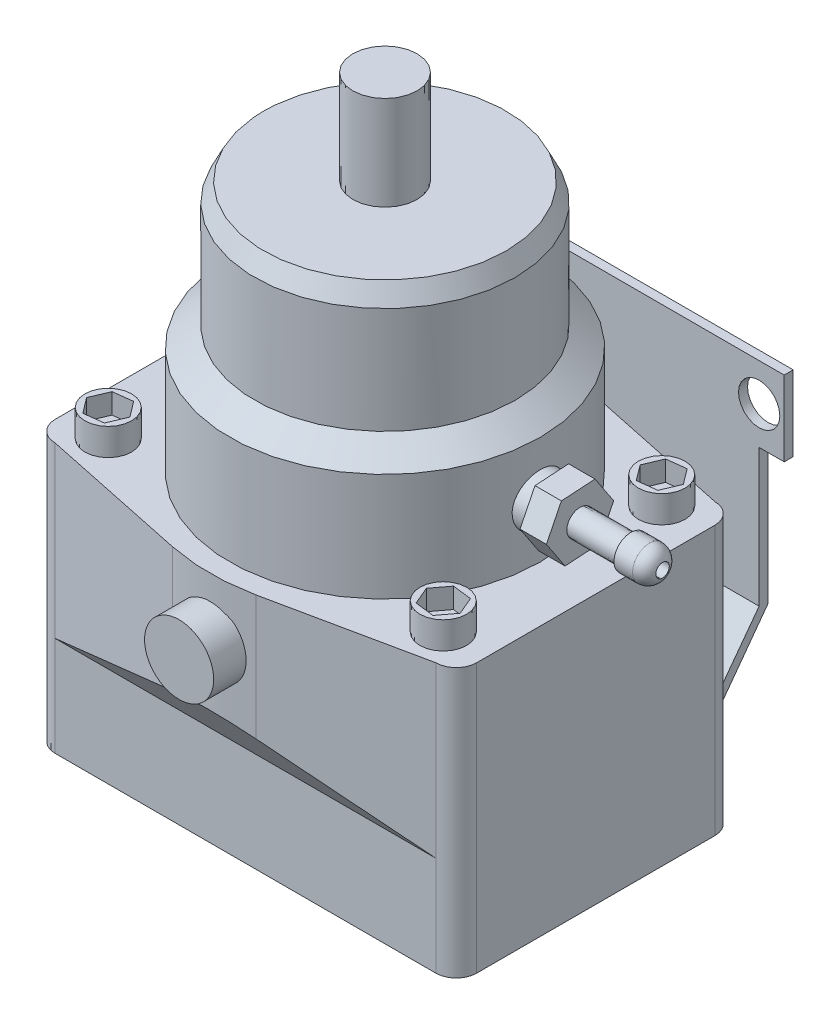
from build123d import *

# Parameters (mm, degrees)
BOSS_EXTRUDE1_DEPTH     = 39.7
BOSS_EXTRUDE2_DEPTH     = 25
CUT_EXTRUDE1_DEPTH      = 100
SKETCH5_R               = 9.905
CUT_EXTRUDE3_DEPTH      = 21.5
SKETCH6_R               = 6.25
CUT_EXTRUDE4_DEPTH      = 37
BOSS_EXTRUDE4_REACH     = 104.296
CUT_EXTRUDE5_DEPTH      = 6
SKETCH12_W              = 10.134962234
SKETCH12_H              = 11.9
CUT_EXTRUDE7_DEPTH      = 1.5
SKETCH13_W              = 5.35926975
SKETCH13_H              = 13.277386283
CUT_EXTRUDE8_DEPTH      = 1.5
SKETCH15_R              = 3.05
CUT_EXTRUDE9_DEPTH      = 5.9
SKETCH16_R              = 4.75
BOSS_EXTRUDE6_DEPTH     = 13.9
SKETCH19_R              = 5.1
BOSS_EXTRUDE7_DEPTH     = 4.8
SKETCH20_R              = 3.45
BOSS_EXTRUDE8_DEPTH     = 4
CUT_EXTRUDE10_DEPTH     = 103
MIRROR3_COPY_1_SKETCH_R = 3.45
MIRROR3_COPY_1_DEPTH    = 4
MIRROR3_COPY_2_DEPTH    = 103
SKETCH22_R              = 3.9
BOSS_EXTRUDE9_DEPTH     = 5.6
CUT_EXTRUDE11_DEPTH     = 3.6
SKETCH24_R              = 3.85
BOSS_EXTRUDE10_DEPTH    = 2.9
BOSS_EXTRUDE11_DEPTH    = 3.9
SKETCH27_R              = 1.95
BOSS_EXTRUDE12_DEPTH    = 7.5
SKETCH28_R              = 2.5
BOSS_EXTRUDE13_DEPTH    = 4.75
FILLET3_R               = 2
SKETCH29_R              = 1
CUT_EXTRUDE12_DEPTH     = 23.75
CUT_SWEEP3_PITCH        = 1
CUT_SWEEP3_HEIGHT       = 13
CUT_SWEEP3_RADIUS       = 4.75
CUT_SWEEP3_START_ANGLE  = -135
SKETCH31_R              = 0.015992225


with BuildPart() as part:
    # Sketch1 → Boss-Extrude1 (new body)
    with BuildSketch(Plane(origin=(0, 0, 0), x_dir=(1, 0, 0), z_dir=(0, 1, 0))):
        with BuildLine():
            Line((28.125, -20.6), (-28.125, -20.6))
            ThreePointArc((-28.125, -20.6), (-30.246320344, -19.721320344), (-31.125, -17.6))
            Line((-31.125, -17.6), (-31.125, 17.6))
            ThreePointArc((-31.125, 17.6), (-30.246320344, 19.721320344), (-28.125, 20.6))
            Line((-28.125, 20.6), (28.125, 20.6))
            ThreePointArc((28.125, 20.6), (30.246320344, 19.721320344), (31.125, 17.6))
            Line((31.125, 17.6), (31.125, -17.6))
            ThreePointArc((31.125, -17.6), (30.246320344, -19.721320344), (28.125, -20.6))
        make_face()
    extrude(amount=BOSS_EXTRUDE1_DEPTH)

    # Sketch2 → Boss-Extrude2 (add)
    with BuildSketch(Plane(origin=(0, 39.7, 0), x_dir=(1, 0, 0), z_dir=(0, 1, 0))):
        with BuildLine():
            Line((-28.125, -20.6), (-6.159267825, -25.207922483))
            ThreePointArc((-6.159267825, -25.207922483), (0, -25.847005946), (6.159267825, -25.207922483))
            Line((6.159267825, -25.207922483), (28.125, -20.6))
            Line((28.125, -20.6), (-28.125, -20.6))
        make_face()
    boss_extrude2 = extrude(amount=-BOSS_EXTRUDE2_DEPTH)

    # Sketch3 → Cut-Extrude1 (cut)
    with BuildSketch(Plane(origin=(31.125, 0, 0), x_dir=(0, 0, -1), z_dir=(1, 0, 0))):
        Polygon((-32.744605148, 11.464392257), (-24.817313872, 11.464392257), (-20.6, 14.7), (-25.847005946, 22.2), (-31.552633413, 18.2083385), align=None)
    cut_extrude1 = extrude(amount=-CUT_EXTRUDE1_DEPTH, mode=Mode.SUBTRACT)

    # Sketch5 → Cut-Extrude3 (cut)
    with BuildSketch(Plane.ZY.offset(31.125)):
        with Locations((0, 17.1)):
            Circle(SKETCH5_R)
    extrude(amount=-CUT_EXTRUDE3_DEPTH, mode=Mode.SUBTRACT)

    # Sketch6 → Cut-Extrude4 (cut)
    with BuildSketch(Plane(origin=(0, 0, 0), x_dir=(-1, 0, 0), z_dir=(0, -1, 0))):
        with Locations(Location((0, 0, 0), (0, 0, 90))):
            Circle(SKETCH6_R)
    extrude(amount=-CUT_EXTRUDE4_DEPTH, mode=Mode.SUBTRACT)

    # Mirror1: Boss-Extrude2, Cut-Extrude1 across plane
    add(boss_extrude2.mirror(Plane.XY))
    add(cut_extrude1.mirror(Plane.XY), mode=Mode.SUBTRACT)

    # Sketch8 → Revolve1 (revolve)
    with BuildSketch(Plane.XY, mode=Mode.PRIVATE) as revolve1_sk:
        Polygon((0, 76.95), (0, 39.7), (22.95, 39.7), (22.95, 55.643444458), (19.24291256, 58.521395188), (19.24291256, 74.221395188), (17.9046595, 76.95), align=None)
    revolve(revolve1_sk.sketch.rotate(Axis((0, 76.95, 0), (0, -1, 0)), 180), axis=Axis((0, 76.95, 0), (0, -1, 0)))

    # Boss-Extrude4: up to this face of the body (flat: up to its plane)
    boss_extrude4_end = Plane(part.part.faces().sort_by_distance((-31.125, 19.85, 17.069422013))[0])
    # Sketch10 → Boss-Extrude4 (add, up to the picked face)
    with BuildSketch(Plane(origin=(31.125, 0, 0), x_dir=(0, 0, -1), z_dir=(1, 0, 0)), mode=Mode.PRIVATE) as boss_extrude4_sk1:
        Polygon((20.6, 0), (22.1, 0), (22.1, 12.5), (29.156948175, 22.081726486), (29.156948175, 53.781726486), (27.821308706, 53.781726486), (27.821308706, 22.374306059), (20.6, 12.680726118), align=None)
    boss_extrude4_tool1 = split(extrude(boss_extrude4_sk1.sketch, amount=-BOSS_EXTRUDE4_REACH, mode=Mode.PRIVATE), bisect_by=boss_extrude4_end, keep=Keep.BOTH, mode=Mode.PRIVATE)
    add(boss_extrude4_tool1.solids().sort_by(Axis((31.125, 0.544582, -21.35), (-1, 0, 0)))[0])

    # Sketch11 → Cut-Extrude5 (cut)
    with BuildSketch(Plane(origin=(0, 0, -32.156948175), x_dir=(-1, 0, 0), z_dir=(0, 0, -1))):
        Polygon((-35.70828559, 51.946762291), (-31.125, 53.781726486), (-31.125, 42.681726486), (-27.425, 42.681726486), (-27.425, 22.081726486), (-35.70828559, 22.081726486), align=None)
        Polygon((31.125, 22.081726486), (27.425, 22.081726486), (27.425, 42.681726486), (31.125, 42.681726486), (31.125, 53.781726486), (39.820148779, 56.491453184), (37.87242411, 26.842755452), align=None)
    extrude(amount=-CUT_EXTRUDE5_DEPTH, mode=Mode.SUBTRACT)

    # Sketch12 → Cut-Extrude7 (cut)
    with BuildSketch(Plane(origin=(0, -6.156667924, -8.359351188), x_dir=(-1, 0, 0), z_dir=(0, -0.5930208550475103, -0.8051870996723182))):
        with Locations((32.492481117, 29.120599642)):
            Rectangle(SKETCH12_W, SKETCH12_H)
        Polygon((-27.425, 35.070599642), (-27.425, 23.170599642), (-42.264689881, 23.170599642), (-41.407824832, 35.070599642), align=None)
    extrude(amount=-CUT_EXTRUDE7_DEPTH, mode=Mode.SUBTRACT)

    # Sketch13 → Cut-Extrude8 (cut)
    with BuildSketch(Plane(origin=(0, 0, -22.1), x_dir=(-1, 0, 0), z_dir=(0, 0, -1))):
        with Locations((-30.104634875, 6.638693142)):
            Rectangle(SKETCH13_W, SKETCH13_H)
        with Locations((30.104634875, 6.638693142)):
            Rectangle(SKETCH13_W, SKETCH13_H)
    extrude(amount=-CUT_EXTRUDE8_DEPTH, mode=Mode.SUBTRACT)

    # Sketch15 → Cut-Extrude9 (cut)
    with BuildSketch(Plane(origin=(0, 0, -32.156948175), x_dir=(-1, 0, 0), z_dir=(0, 0, -1))):
        with Locations((27.425, 48.231726486)):
            Circle(SKETCH15_R)
        with Locations((-27.425, 48.231726486)):
            Circle(SKETCH15_R)
    extrude(amount=-CUT_EXTRUDE9_DEPTH, mode=Mode.SUBTRACT)

    # Sketch16 → Boss-Extrude6 (add)
    with BuildSketch(Plane(origin=(0, 76.95, 0), x_dir=(1, 0, 0), z_dir=(0, 1, 0))):
        Circle(SKETCH16_R)
    extrude(amount=BOSS_EXTRUDE6_DEPTH)

    # Sketch20 → Boss-Extrude8 (add)
    with BuildSketch(Plane(origin=(0, 39.7, 0), x_dir=(1, 0, 0), z_dir=(0, 1, 0))):
        with Locations(Location((-24.735401996, 16.128070491, 0), (0, 0, 90))):
            Circle(SKETCH20_R)
    boss_extrude8 = extrude(amount=BOSS_EXTRUDE8_DEPTH)

    # Sketch21 → Cut-Extrude10 (cut)
    with BuildSketch(Plane(origin=(0, 143.7, 0), x_dir=(1, 0, 0), z_dir=(0, 1, 0))):
        Polygon((-23.61717672, 13.490155922), (-21.891788328, 15.777524703), (-23.010013605, 18.415439272), (-25.853627273, 18.76598506), (-27.579015664, 16.478616279), (-26.460790388, 13.84070171), align=None)
    cut_extrude10 = extrude(amount=-CUT_EXTRUDE10_DEPTH, mode=Mode.SUBTRACT)

    # Mirror2: Boss-Extrude8, Cut-Extrude10 across plane
    add(boss_extrude8.mirror(Plane(origin=(0, 0, 0), x_dir=(0, 0, 1), z_dir=(1, 0, 0))))
    add(cut_extrude10.mirror(Plane(origin=(0, 0, 0), x_dir=(0, 0, 1), z_dir=(1, 0, 0))), mode=Mode.SUBTRACT)

    # Mirror3: Boss-Extrude8, Cut-Extrude10 across plane
    add(boss_extrude8.mirror(Plane.XY))
    add(cut_extrude10.mirror(Plane.XY), mode=Mode.SUBTRACT)

    # Mirror3 copy 1 sketch → Mirror3 copy 1 (add)
    with BuildSketch(Plane(origin=(0, 39.7, 0), x_dir=(-1, 0, 0), z_dir=(0, 1, 0))):
        with Locations(Location((-24.735401996, 16.128070491, 0), (0, 0, 90))):
            Circle(MIRROR3_COPY_1_SKETCH_R)
    extrude(amount=MIRROR3_COPY_1_DEPTH)

    # Mirror3 copy 2 sketch → Mirror3 copy 2 (cut)
    with BuildSketch(Plane(origin=(0, 143.7, 0), x_dir=(-1, 0, 0), z_dir=(0, 1, 0))):
        Polygon((-23.61717672, 13.490155922), (-21.891788328, 15.777524703), (-23.010013605, 18.415439272), (-25.853627273, 18.76598506), (-27.579015664, 16.478616279), (-26.460790388, 13.84070171), align=None)
    extrude(amount=-MIRROR3_COPY_2_DEPTH, mode=Mode.SUBTRACT)

    # Sketch22 → Boss-Extrude9 (add)
    with BuildSketch(Plane(origin=(0, 0, -22.1), x_dir=(-1, 0, 0), z_dir=(0, 0, -1))):
        with Locations((-17.884781709, 6.308928846)):
            Circle(SKETCH22_R)
    boss_extrude9 = extrude(amount=BOSS_EXTRUDE9_DEPTH)

    # Sketch23 → Cut-Extrude11 (cut)
    with BuildSketch(Plane(origin=(0, 0, -27.7), x_dir=(-1, 0, 0), z_dir=(0, 0, -1))):
        Polygon((-16.352393781, 3.841373628), (-14.981622242, 6.402238112), (-16.514010171, 8.869793329), (-19.417169638, 8.776484063), (-20.787941177, 6.215619579), (-19.255553248, 3.748064362), align=None)
    cut_extrude11 = extrude(amount=-CUT_EXTRUDE11_DEPTH, mode=Mode.SUBTRACT)

    # Mirror4: Boss-Extrude9, Cut-Extrude11 across plane
    add(boss_extrude9.mirror(Plane(origin=(0, 0, 0), x_dir=(0, 0, 1), z_dir=(1, 0, 0))))
    add(cut_extrude11.mirror(Plane(origin=(0, 0, 0), x_dir=(0, 0, 1), z_dir=(1, 0, 0))), mode=Mode.SUBTRACT)

    # Sketch24 → Boss-Extrude10 (add)
    with BuildSketch(Plane(origin=(22, 0, 0), x_dir=(0, 0, -1), z_dir=(1, 0, 0))):
        with Locations(Location((0, 47.671722229, 0), (0, 0, 180))):
            Circle(SKETCH24_R)
    extrude(amount=BOSS_EXTRUDE10_DEPTH)

    # Sketch25 → Boss-Extrude11 (add)
    with BuildSketch(Plane(origin=(24.9, 0, 0), x_dir=(0, 0, -1), z_dir=(1, 0, 0))):
        Polygon((2.751155305, 43.527866815), (4.96426171, 47.982364906), (2.213106406, 52.12622032), (-2.751155305, 51.815577643), (-4.96426171, 47.361079552), (-2.213106406, 43.217224138), align=None)
    extrude(amount=BOSS_EXTRUDE11_DEPTH)

    # Sketch27 → Boss-Extrude12 (add)
    with BuildSketch(Plane(origin=(28.8, 0, 0), x_dir=(0, 0, -1), z_dir=(1, 0, 0))):
        with Locations((0, 47.671722229)):
            Circle(SKETCH27_R)
    extrude(amount=BOSS_EXTRUDE12_DEPTH)

    # Sketch28 → Boss-Extrude13 (add)
    with BuildSketch(Plane(origin=(36.3, 0, 0), x_dir=(0, 0, -1), z_dir=(1, 0, 0))):
        with Locations((0, 47.671722229)):
            Circle(SKETCH28_R)
    extrude(amount=BOSS_EXTRUDE13_DEPTH)

    # Fillet3
    fillet3_edges = [part.edges().sort_by_distance(p)[0] for p in [
        (41.05, 47.671722229, 2.5),
    ]]
    fillet(fillet3_edges, radius=FILLET3_R)

    # Sketch29 → Cut-Extrude12 (cut)
    with BuildSketch(Plane(origin=(41.05, 0, 0), x_dir=(0, 0, -1), z_dir=(1, 0, 0))):
        with Locations((0, 47.671722229)):
            Circle(SKETCH29_R)
    extrude(amount=-CUT_EXTRUDE12_DEPTH, mode=Mode.SUBTRACT)

    # Cut-Sweep3: sweep along a helix
    with BuildLine() as cut_sweep3_path:
        add(Helix(CUT_SWEEP3_PITCH, CUT_SWEEP3_HEIGHT, CUT_SWEEP3_RADIUS, center=(0, 90.85, 0), direction=(0, -1, 0), mode=Mode.PRIVATE).rotate(Axis((0, 90.85, 0), (0, -1, 0)), CUT_SWEEP3_START_ANGLE))
    # Sketch31 → Cut-Sweep3 (sweep, cut)
    with BuildSketch(Plane.XY.offset(3.358757211)):
        with Locations((-3.27807503, 90.822346747)):
            Circle(SKETCH31_R)
    sweep(path=cut_sweep3_path.line, is_frenet=True, mode=Mode.SUBTRACT)


with BuildPart() as body_2:
    # Sketch19 → Boss-Extrude7 (new body)
    with BuildSketch(Plane.XY.offset(25.6)):
        with Locations((0, 30.95)):
            Circle(SKETCH19_R)
    extrude(amount=BOSS_EXTRUDE7_DEPTH)


solid = Compound([part.part, body_2.part])
